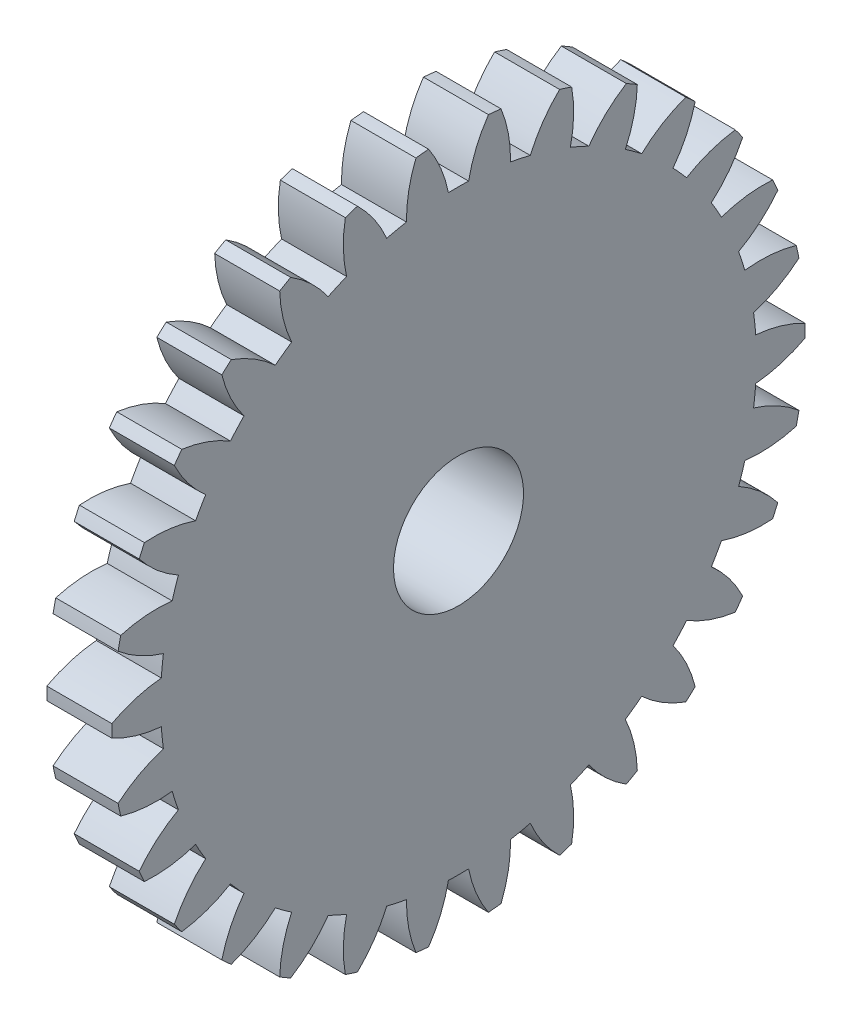
from build123d import *

# Parameters (mm, degrees)
BASPROSKE_W      = 3
BASPROSKE_H      = 16
TOOTHCUT_DEPTH   = 23.825424421
TEETHCUTS_COUNT  = 30
TEETHCUTS_ANGLE  = 348
HUBNEAONESKE_R   = 9
HUBNEARONE_DEPTH = 3.0000508
BORSKE_R         = 3
BORE_DEPTH       = 6.0000508


with BuildPart() as part:
    # BasProSke → Base-Revolve (revolve)
    with BuildSketch(Plane(origin=(0, 0, 0), x_dir=(1, 0, 0), z_dir=(0, 1, 0)), mode=Mode.PRIVATE) as base_revolve_sk:
        with Locations((1.5, 8)):
            Rectangle(BASPROSKE_W, BASPROSKE_H)
    revolve(base_revolve_sk.sketch.rotate(Axis((-10, 0, 0), (1, 0, 0)), 180), axis=Axis((-10, 0, 0), (1, 0, 0)))

    # TooCutSke → ToothCut (cut, through all)
    with BuildSketch(Plane(origin=(0, 0, 0), x_dir=(0, 0, -1), z_dir=(1, 0, 0))):
        with BuildLine():
            ThreePointArc((0.466400716, 13.741086979), (0, 13.749), (-0.466400716, 13.741086979))
            ThreePointArc((-0.466400716, 13.741086979), (-0.819142092, 14.899954875), (-1.3974676, 15.964351834))
            ThreePointArc((-1.3974676, 15.964351834), (0, 16.0254), (1.3974676, 15.964351834))
            ThreePointArc((1.3974676, 15.964351834), (0.819142092, 14.899954875), (0.466400716, 13.741086979))
        make_face()
    toothcut = extrude(amount=TOOTHCUT_DEPTH, mode=Mode.SUBTRACT)

    # TeethCuts: ToothCut ×30 about axis
    teethcuts_axis = Axis((-10, 0, 0), (1, 0, 0))
    for i in range(1, TEETHCUTS_COUNT):
        add(toothcut.rotate(teethcuts_axis, i * TEETHCUTS_ANGLE / (TEETHCUTS_COUNT - 1)), mode=Mode.SUBTRACT)

    # HubNeaOneSke → HubNearOne (add)
    with BuildSketch(Plane.ZY):
        with Locations(Location((0, 0, 0), (0, 0, 180))):
            Circle(HUBNEAONESKE_R)
    extrude(amount=HUBNEARONE_DEPTH)

    # BorSke → Bore (cut, symmetric)
    with BuildSketch(Plane(origin=(0, 0, 0), x_dir=(0, 0, -1), z_dir=(1, 0, 0))):
        with Locations(Location((0, 0, 0), (0, 0, 180))):
            Circle(BORSKE_R)
    extrude(amount=BORE_DEPTH, both=True, mode=Mode.SUBTRACT)


solid = part.part
